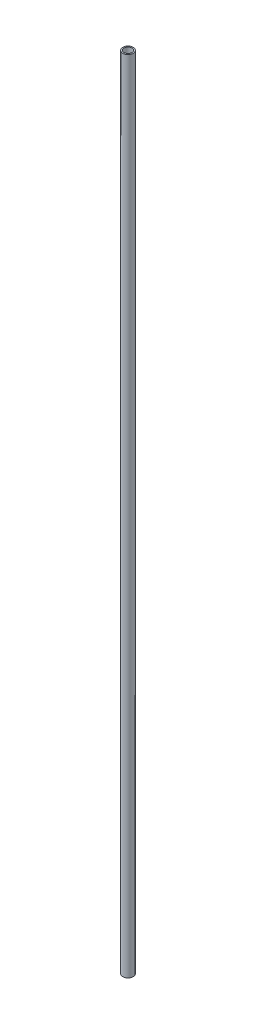
from build123d import *

# Parameters (mm, degrees)
SKETCH2_R   = 4
SKETCH2_R_2 = 3


with BuildPart() as part:
    # Sweep1: sweep along a path in Sketch1
    with BuildLine(Plane.XY) as sweep1_path:
        Line((0, 0), (0, 610))
    # Sketch2 → Sweep1 (sweep)
    with BuildSketch(Plane(origin=(0, 0, 0), x_dir=(1, 0, 0), z_dir=(0, 1, 0))):
        Circle(SKETCH2_R)
        Circle(SKETCH2_R_2, mode=Mode.SUBTRACT)
    sweep(path=sweep1_path.line)


solid = part.part
